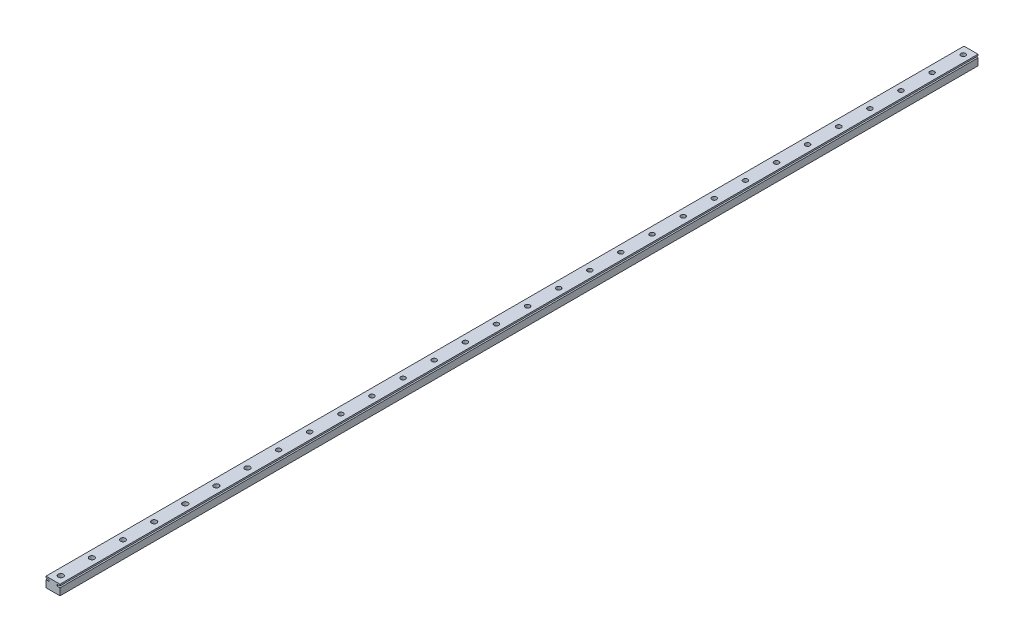
from build123d import *

# Parameters (mm, degrees)
SKETCH_1_W          = 9
SKETCH_1_H          = 6.5
EXTRUDE_1_DEPTH     = 590
SKETCH_2_W          = 2
SKETCH_2_H          = 1
CUT_EXTRUDE_1_DEPTH = 610
CUT_EXTRUDE_2_REACH = 592.104
SKETCH_3_R          = 1.5
SKETCH_4_R          = 1.656535544
CUT_EXTRUDE_3_DEPTH = 10


with BuildPart() as part:
    # 草图1 → 凸台-拉伸1 (new body)
    with BuildSketch(Plane.XY):
        with Locations((-4.5, 3.25)):
            Rectangle(SKETCH_1_W, SKETCH_1_H)
    extrude(amount=EXTRUDE_1_DEPTH)

    # 草图2 → 切除-拉伸1 (cut)
    with BuildSketch(Plane(origin=(0, 0, 0), x_dir=(-1, 0, 0), z_dir=(0, 0, -1))):
        with Locations((1, 5)):
            Rectangle(SKETCH_2_W, SKETCH_2_H)
        with Locations((8, 5)):
            Rectangle(SKETCH_2_W, SKETCH_2_H)
    extrude(amount=-CUT_EXTRUDE_1_DEPTH, mode=Mode.SUBTRACT)

    # 草图3 → 切除-拉伸2 (cut, up to next)
    with BuildSketch(Plane(origin=(0, 6.5, 0), x_dir=(1, 0, 0), z_dir=(0, 1, 0)), mode=Mode.PRIVATE) as cut_extrude_2_sk1:
        with Locations(Location((-4.5, -5, 0), (0, 0, 180))):
            Circle(SKETCH_3_R)
    cut_extrude_2_tool1 = extrude(cut_extrude_2_sk1.sketch, amount=-CUT_EXTRUDE_2_REACH, mode=Mode.PRIVATE) & part.part
    # 草图3 → 切除-拉伸2 (cut, up to next)
    with BuildSketch(Plane(origin=(0, 6.5, 0), x_dir=(1, 0, 0), z_dir=(0, 1, 0)), mode=Mode.PRIVATE) as cut_extrude_2_sk2:
        with Locations(Location((-4.5, -25, 0), (0, 0, 180))):
            Circle(SKETCH_3_R)
    cut_extrude_2_tool2 = extrude(cut_extrude_2_sk2.sketch, amount=-CUT_EXTRUDE_2_REACH, mode=Mode.PRIVATE) & part.part
    # 草图3 → 切除-拉伸2 (cut, up to next)
    with BuildSketch(Plane(origin=(0, 6.5, 0), x_dir=(1, 0, 0), z_dir=(0, 1, 0)), mode=Mode.PRIVATE) as cut_extrude_2_sk3:
        with Locations(Location((-4.5, -45, 0), (0, 0, 180))):
            Circle(SKETCH_3_R)
    cut_extrude_2_tool3 = extrude(cut_extrude_2_sk3.sketch, amount=-CUT_EXTRUDE_2_REACH, mode=Mode.PRIVATE) & part.part
    # 草图3 → 切除-拉伸2 (cut, up to next)
    with BuildSketch(Plane(origin=(0, 6.5, 0), x_dir=(1, 0, 0), z_dir=(0, 1, 0)), mode=Mode.PRIVATE) as cut_extrude_2_sk4:
        with Locations(Location((-4.5, -65, 0), (0, 0, 180))):
            Circle(SKETCH_3_R)
    cut_extrude_2_tool4 = extrude(cut_extrude_2_sk4.sketch, amount=-CUT_EXTRUDE_2_REACH, mode=Mode.PRIVATE) & part.part
    # 草图3 → 切除-拉伸2 (cut, up to next)
    with BuildSketch(Plane(origin=(0, 6.5, 0), x_dir=(1, 0, 0), z_dir=(0, 1, 0)), mode=Mode.PRIVATE) as cut_extrude_2_sk5:
        with Locations(Location((-4.5, -85, 0), (0, 0, 180))):
            Circle(SKETCH_3_R)
    cut_extrude_2_tool5 = extrude(cut_extrude_2_sk5.sketch, amount=-CUT_EXTRUDE_2_REACH, mode=Mode.PRIVATE) & part.part
    # 草图3 → 切除-拉伸2 (cut, up to next)
    with BuildSketch(Plane(origin=(0, 6.5, 0), x_dir=(1, 0, 0), z_dir=(0, 1, 0)), mode=Mode.PRIVATE) as cut_extrude_2_sk6:
        with Locations(Location((-4.5, -105, 0), (0, 0, 180))):
            Circle(SKETCH_3_R)
    cut_extrude_2_tool6 = extrude(cut_extrude_2_sk6.sketch, amount=-CUT_EXTRUDE_2_REACH, mode=Mode.PRIVATE) & part.part
    # 草图3 → 切除-拉伸2 (cut, up to next)
    with BuildSketch(Plane(origin=(0, 6.5, 0), x_dir=(1, 0, 0), z_dir=(0, 1, 0)), mode=Mode.PRIVATE) as cut_extrude_2_sk7:
        with Locations(Location((-4.5, -125, 0), (0, 0, 180))):
            Circle(SKETCH_3_R)
    cut_extrude_2_tool7 = extrude(cut_extrude_2_sk7.sketch, amount=-CUT_EXTRUDE_2_REACH, mode=Mode.PRIVATE) & part.part
    # 草图3 → 切除-拉伸2 (cut, up to next)
    with BuildSketch(Plane(origin=(0, 6.5, 0), x_dir=(1, 0, 0), z_dir=(0, 1, 0)), mode=Mode.PRIVATE) as cut_extrude_2_sk8:
        with Locations(Location((-4.5, -145, 0), (0, 0, 180))):
            Circle(SKETCH_3_R)
    cut_extrude_2_tool8 = extrude(cut_extrude_2_sk8.sketch, amount=-CUT_EXTRUDE_2_REACH, mode=Mode.PRIVATE) & part.part
    # 草图3 → 切除-拉伸2 (cut, up to next)
    with BuildSketch(Plane(origin=(0, 6.5, 0), x_dir=(1, 0, 0), z_dir=(0, 1, 0)), mode=Mode.PRIVATE) as cut_extrude_2_sk9:
        with Locations(Location((-4.5, -165, 0), (0, 0, 180))):
            Circle(SKETCH_3_R)
    cut_extrude_2_tool9 = extrude(cut_extrude_2_sk9.sketch, amount=-CUT_EXTRUDE_2_REACH, mode=Mode.PRIVATE) & part.part
    # 草图3 → 切除-拉伸2 (cut, up to next)
    with BuildSketch(Plane(origin=(0, 6.5, 0), x_dir=(1, 0, 0), z_dir=(0, 1, 0)), mode=Mode.PRIVATE) as cut_extrude_2_sk10:
        with Locations(Location((-4.5, -185, 0), (0, 0, 180))):
            Circle(SKETCH_3_R)
    cut_extrude_2_tool10 = extrude(cut_extrude_2_sk10.sketch, amount=-CUT_EXTRUDE_2_REACH, mode=Mode.PRIVATE) & part.part
    # 草图3 → 切除-拉伸2 (cut, up to next)
    with BuildSketch(Plane(origin=(0, 6.5, 0), x_dir=(1, 0, 0), z_dir=(0, 1, 0)), mode=Mode.PRIVATE) as cut_extrude_2_sk11:
        with Locations(Location((-4.5, -205, 0), (0, 0, 180))):
            Circle(SKETCH_3_R)
    cut_extrude_2_tool11 = extrude(cut_extrude_2_sk11.sketch, amount=-CUT_EXTRUDE_2_REACH, mode=Mode.PRIVATE) & part.part
    # 草图3 → 切除-拉伸2 (cut, up to next)
    with BuildSketch(Plane(origin=(0, 6.5, 0), x_dir=(1, 0, 0), z_dir=(0, 1, 0)), mode=Mode.PRIVATE) as cut_extrude_2_sk12:
        with Locations(Location((-4.5, -225, 0), (0, 0, 180))):
            Circle(SKETCH_3_R)
    cut_extrude_2_tool12 = extrude(cut_extrude_2_sk12.sketch, amount=-CUT_EXTRUDE_2_REACH, mode=Mode.PRIVATE) & part.part
    # 草图3 → 切除-拉伸2 (cut, up to next)
    with BuildSketch(Plane(origin=(0, 6.5, 0), x_dir=(1, 0, 0), z_dir=(0, 1, 0)), mode=Mode.PRIVATE) as cut_extrude_2_sk13:
        with Locations(Location((-4.5, -245, 0), (0, 0, 180))):
            Circle(SKETCH_3_R)
    cut_extrude_2_tool13 = extrude(cut_extrude_2_sk13.sketch, amount=-CUT_EXTRUDE_2_REACH, mode=Mode.PRIVATE) & part.part
    # 草图3 → 切除-拉伸2 (cut, up to next)
    with BuildSketch(Plane(origin=(0, 6.5, 0), x_dir=(1, 0, 0), z_dir=(0, 1, 0)), mode=Mode.PRIVATE) as cut_extrude_2_sk14:
        with Locations(Location((-4.5, -265, 0), (0, 0, 180))):
            Circle(SKETCH_3_R)
    cut_extrude_2_tool14 = extrude(cut_extrude_2_sk14.sketch, amount=-CUT_EXTRUDE_2_REACH, mode=Mode.PRIVATE) & part.part
    # 草图3 → 切除-拉伸2 (cut, up to next)
    with BuildSketch(Plane(origin=(0, 6.5, 0), x_dir=(1, 0, 0), z_dir=(0, 1, 0)), mode=Mode.PRIVATE) as cut_extrude_2_sk15:
        with Locations(Location((-4.5, -285, 0), (0, 0, 180))):
            Circle(SKETCH_3_R)
    cut_extrude_2_tool15 = extrude(cut_extrude_2_sk15.sketch, amount=-CUT_EXTRUDE_2_REACH, mode=Mode.PRIVATE) & part.part
    # 草图3 → 切除-拉伸2 (cut, up to next)
    with BuildSketch(Plane(origin=(0, 6.5, 0), x_dir=(1, 0, 0), z_dir=(0, 1, 0)), mode=Mode.PRIVATE) as cut_extrude_2_sk16:
        with Locations(Location((-4.5, -305, 0), (0, 0, 180))):
            Circle(SKETCH_3_R)
    cut_extrude_2_tool16 = extrude(cut_extrude_2_sk16.sketch, amount=-CUT_EXTRUDE_2_REACH, mode=Mode.PRIVATE) & part.part
    # 草图3 → 切除-拉伸2 (cut, up to next)
    with BuildSketch(Plane(origin=(0, 6.5, 0), x_dir=(1, 0, 0), z_dir=(0, 1, 0)), mode=Mode.PRIVATE) as cut_extrude_2_sk17:
        with Locations(Location((-4.5, -325, 0), (0, 0, 180))):
            Circle(SKETCH_3_R)
    cut_extrude_2_tool17 = extrude(cut_extrude_2_sk17.sketch, amount=-CUT_EXTRUDE_2_REACH, mode=Mode.PRIVATE) & part.part
    # 草图3 → 切除-拉伸2 (cut, up to next)
    with BuildSketch(Plane(origin=(0, 6.5, 0), x_dir=(1, 0, 0), z_dir=(0, 1, 0)), mode=Mode.PRIVATE) as cut_extrude_2_sk18:
        with Locations(Location((-4.5, -345, 0), (0, 0, 180))):
            Circle(SKETCH_3_R)
    cut_extrude_2_tool18 = extrude(cut_extrude_2_sk18.sketch, amount=-CUT_EXTRUDE_2_REACH, mode=Mode.PRIVATE) & part.part
    # 草图3 → 切除-拉伸2 (cut, up to next)
    with BuildSketch(Plane(origin=(0, 6.5, 0), x_dir=(1, 0, 0), z_dir=(0, 1, 0)), mode=Mode.PRIVATE) as cut_extrude_2_sk19:
        with Locations(Location((-4.5, -365, 0), (0, 0, 180))):
            Circle(SKETCH_3_R)
    cut_extrude_2_tool19 = extrude(cut_extrude_2_sk19.sketch, amount=-CUT_EXTRUDE_2_REACH, mode=Mode.PRIVATE) & part.part
    # 草图3 → 切除-拉伸2 (cut, up to next)
    with BuildSketch(Plane(origin=(0, 6.5, 0), x_dir=(1, 0, 0), z_dir=(0, 1, 0)), mode=Mode.PRIVATE) as cut_extrude_2_sk20:
        with Locations(Location((-4.5, -385, 0), (0, 0, 180))):
            Circle(SKETCH_3_R)
    cut_extrude_2_tool20 = extrude(cut_extrude_2_sk20.sketch, amount=-CUT_EXTRUDE_2_REACH, mode=Mode.PRIVATE) & part.part
    # 草图3 → 切除-拉伸2 (cut, up to next)
    with BuildSketch(Plane(origin=(0, 6.5, 0), x_dir=(1, 0, 0), z_dir=(0, 1, 0)), mode=Mode.PRIVATE) as cut_extrude_2_sk21:
        with Locations(Location((-4.5, -405, 0), (0, 0, 180))):
            Circle(SKETCH_3_R)
    cut_extrude_2_tool21 = extrude(cut_extrude_2_sk21.sketch, amount=-CUT_EXTRUDE_2_REACH, mode=Mode.PRIVATE) & part.part
    # 草图3 → 切除-拉伸2 (cut, up to next)
    with BuildSketch(Plane(origin=(0, 6.5, 0), x_dir=(1, 0, 0), z_dir=(0, 1, 0)), mode=Mode.PRIVATE) as cut_extrude_2_sk22:
        with Locations(Location((-4.5, -425, 0), (0, 0, 180))):
            Circle(SKETCH_3_R)
    cut_extrude_2_tool22 = extrude(cut_extrude_2_sk22.sketch, amount=-CUT_EXTRUDE_2_REACH, mode=Mode.PRIVATE) & part.part
    # 草图3 → 切除-拉伸2 (cut, up to next)
    with BuildSketch(Plane(origin=(0, 6.5, 0), x_dir=(1, 0, 0), z_dir=(0, 1, 0)), mode=Mode.PRIVATE) as cut_extrude_2_sk23:
        with Locations(Location((-4.5, -445, 0), (0, 0, 180))):
            Circle(SKETCH_3_R)
    cut_extrude_2_tool23 = extrude(cut_extrude_2_sk23.sketch, amount=-CUT_EXTRUDE_2_REACH, mode=Mode.PRIVATE) & part.part
    add(cut_extrude_2_tool1.solids().sort_by_distance((-4.5, 6.5, 5))[0], mode=Mode.SUBTRACT)
    add(cut_extrude_2_tool2.solids().sort_by_distance((-4.5, 6.5, 25))[0], mode=Mode.SUBTRACT)
    add(cut_extrude_2_tool3.solids().sort_by_distance((-4.5, 6.5, 45))[0], mode=Mode.SUBTRACT)
    add(cut_extrude_2_tool4.solids().sort_by_distance((-4.5, 6.5, 65))[0], mode=Mode.SUBTRACT)
    add(cut_extrude_2_tool5.solids().sort_by_distance((-4.5, 6.5, 85))[0], mode=Mode.SUBTRACT)
    add(cut_extrude_2_tool6.solids().sort_by_distance((-4.5, 6.5, 105))[0], mode=Mode.SUBTRACT)
    add(cut_extrude_2_tool7.solids().sort_by_distance((-4.5, 6.5, 125))[0], mode=Mode.SUBTRACT)
    add(cut_extrude_2_tool8.solids().sort_by_distance((-4.5, 6.5, 145))[0], mode=Mode.SUBTRACT)
    add(cut_extrude_2_tool9.solids().sort_by_distance((-4.5, 6.5, 165))[0], mode=Mode.SUBTRACT)
    add(cut_extrude_2_tool10.solids().sort_by_distance((-4.5, 6.5, 185))[0], mode=Mode.SUBTRACT)
    add(cut_extrude_2_tool11.solids().sort_by_distance((-4.5, 6.5, 205))[0], mode=Mode.SUBTRACT)
    add(cut_extrude_2_tool12.solids().sort_by_distance((-4.5, 6.5, 225))[0], mode=Mode.SUBTRACT)
    add(cut_extrude_2_tool13.solids().sort_by_distance((-4.5, 6.5, 245))[0], mode=Mode.SUBTRACT)
    add(cut_extrude_2_tool14.solids().sort_by_distance((-4.5, 6.5, 265))[0], mode=Mode.SUBTRACT)
    add(cut_extrude_2_tool15.solids().sort_by_distance((-4.5, 6.5, 285))[0], mode=Mode.SUBTRACT)
    add(cut_extrude_2_tool16.solids().sort_by_distance((-4.5, 6.5, 305))[0], mode=Mode.SUBTRACT)
    add(cut_extrude_2_tool17.solids().sort_by_distance((-4.5, 6.5, 325))[0], mode=Mode.SUBTRACT)
    add(cut_extrude_2_tool18.solids().sort_by_distance((-4.5, 6.5, 345))[0], mode=Mode.SUBTRACT)
    add(cut_extrude_2_tool19.solids().sort_by_distance((-4.5, 6.5, 365))[0], mode=Mode.SUBTRACT)
    add(cut_extrude_2_tool20.solids().sort_by_distance((-4.5, 6.5, 385))[0], mode=Mode.SUBTRACT)
    add(cut_extrude_2_tool21.solids().sort_by_distance((-4.5, 6.5, 405))[0], mode=Mode.SUBTRACT)
    add(cut_extrude_2_tool22.solids().sort_by_distance((-4.5, 6.5, 425))[0], mode=Mode.SUBTRACT)
    add(cut_extrude_2_tool23.solids().sort_by_distance((-4.5, 6.5, 445))[0], mode=Mode.SUBTRACT)

    # 草图4 → 切除-拉伸3 (cut)
    with BuildSketch(Plane(origin=(0, 6.5, 0), x_dir=(1, 0, 0), z_dir=(0, 1, 0))):
        with Locations(Location((-4.5, -465, 0), (0, 0, 180))):
            Circle(SKETCH_4_R)
        with Locations(Location((-4.5, -485, 0), (0, 0, 180))):
            Circle(SKETCH_4_R)
        with Locations(Location((-4.5, -505, 0), (0, 0, 180))):
            Circle(SKETCH_4_R)
        with Locations(Location((-4.5, -525, 0), (0, 0, 180))):
            Circle(SKETCH_4_R)
        with Locations(Location((-4.5, -545, 0), (0, 0, 180))):
            Circle(SKETCH_4_R)
        with Locations(Location((-4.5, -565, 0), (0, 0, 180))):
            Circle(SKETCH_4_R)
        with Locations(Location((-4.5, -585, 0), (0, 0, 180))):
            Circle(SKETCH_4_R)
    extrude(amount=-CUT_EXTRUDE_3_DEPTH, mode=Mode.SUBTRACT)


solid = part.part
